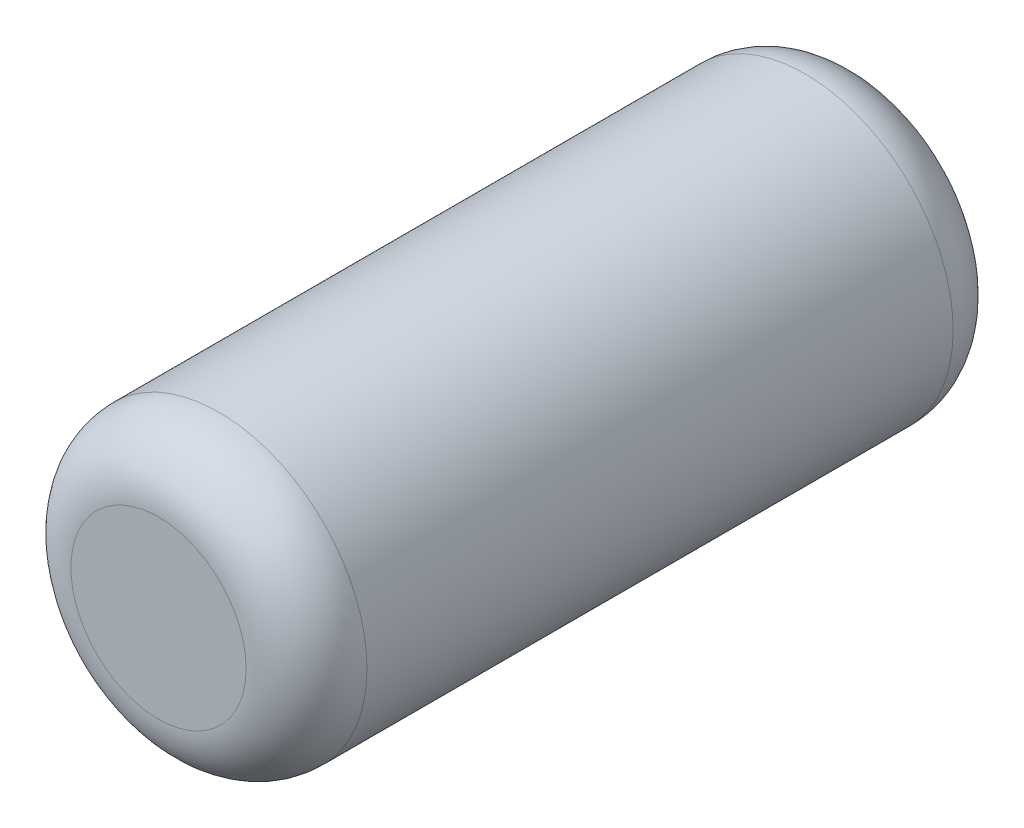
from build123d import *

# Parameters (mm, degrees)
SKETCH1_R           = 49
BOSS_EXTRUDE1_DEPTH = 117
FILLET1_R           = 20


with BuildPart() as part:
    # Sketch1 → Boss-Extrude1 (new, symmetric)
    with BuildSketch(Plane.XY):
        Circle(SKETCH1_R)
    extrude(amount=BOSS_EXTRUDE1_DEPTH, both=True)

    # Fillet1
    fillet1_edges = [part.edges().sort_by_distance(p)[0] for p in [
        (-49, 0, -117),
        (-49, 0, 117),
    ]]
    fillet(fillet1_edges, radius=FILLET1_R)


solid = part.part
